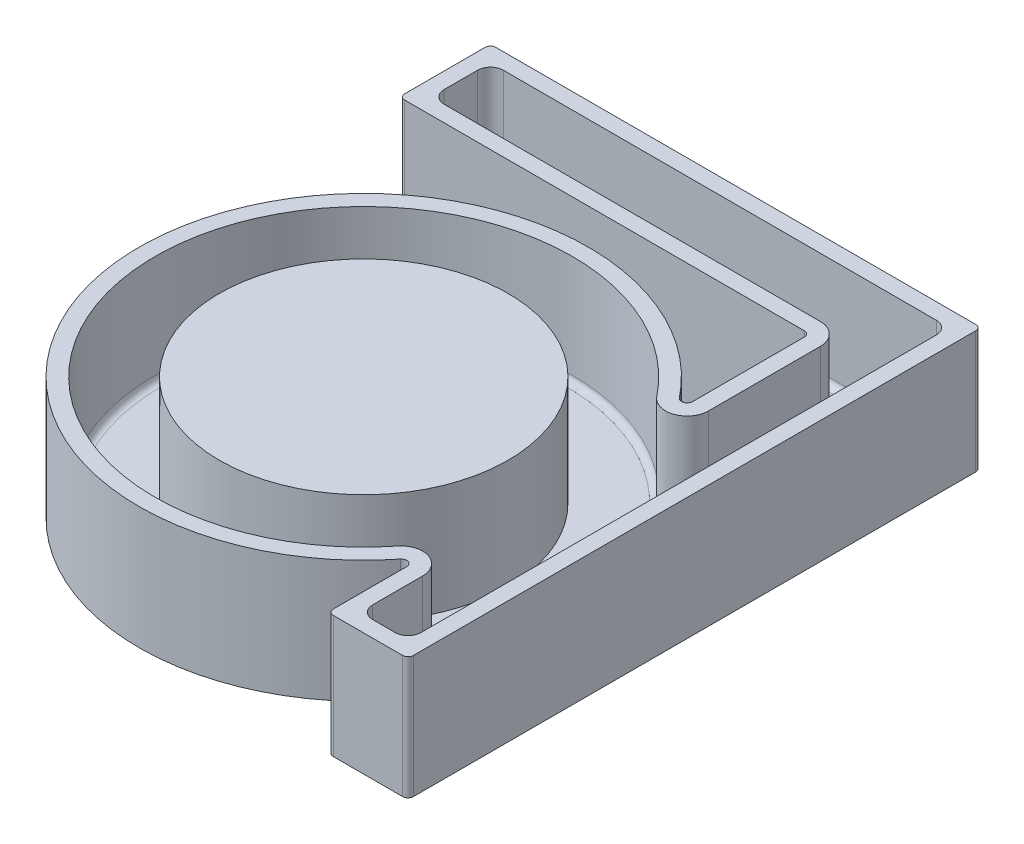
from build123d import *

# Parameters (mm, degrees)
BOSS_EXTRUDE1_DEPTH = 19.05
SKETCH2_R           = 22.5
CUT_EXTRUDE1_DEPTH  = 17.05
FILLET1_R           = 2
FILLET2_R           = 1


with BuildPart() as part:
    # Sketch1 → Boss-Extrude1 (new body)
    with BuildSketch(Plane(origin=(0, 0, 0), x_dir=(1, 0, 0), z_dir=(0, 1, 0))):
        with BuildLine():
            Line((30.602986827, -26.563786798), (41.395992873, -26.563786798))
            ThreePointArc((41.395992873, -26.563786798), (41.999506373, -26.313803321), (42.24948985, -25.710289821))
            Line((42.24948985, -25.710289821), (42.24948985, 54.289710179))
            Line((42.24948985, 54.289710179), (42.24948985, 61.876099251))
            ThreePointArc((42.24948985, 61.876099251), (41.999506373, 62.479612751), (41.395992873, 62.729596228))
            Line((41.395992873, 62.729596228), (-33.347013177, 62.729596228))
            ThreePointArc((-33.347013177, 62.729596228), (-33.950526677, 62.479612751), (-34.200510153, 61.876099251))
            Line((-34.200510153, 61.876099251), (-34.200510153, 49.376099251))
            ThreePointArc((-34.200510153, 49.376099251), (-33.950526677, 48.772585752), (-33.347013177, 48.522602275))
            Line((-33.347013177, 48.522602275), (28.895992873, 48.522602275))
            ThreePointArc((28.895992873, 48.522602275), (29.499506373, 48.272618798), (29.74948985, 47.669105298))
            Line((29.74948985, 47.669105298), (29.74948985, 30.255903719))
            ThreePointArc((29.74948985, 30.255903719), (29.176620882, 29.44986091), (28.227035694, 29.725853361))
            ThreePointArc((28.227035694, 29.725853361), (-34.205400414, 7.989675013), (28.227035694, -13.746503336))
            ThreePointArc((28.227035694, -13.746503336), (29.176620882, -13.470510884), (29.74948985, -14.276553693))
            Line((29.74948985, -14.276553693), (29.74948985, -25.710289821))
            ThreePointArc((29.74948985, -25.710289821), (29.999473327, -26.313803321), (30.602986827, -26.563786798))
        make_face()
    extrude(amount=BOSS_EXTRUDE1_DEPTH)

    # Sketch2 → Cut-Extrude1 (cut)
    with BuildSketch(Plane(origin=(0, 19.05, 0), x_dir=(1, 0, 0), z_dir=(0, 1, 0))):
        with BuildLine():
            Line((39.74948985, -24.063786798), (39.74948985, 60.229596228))
            Line((39.74948985, 60.229596228), (-31.700510153, 60.229596228))
            Line((-31.700510153, 60.229596228), (-31.700510153, 51.022602275))
            Line((-31.700510153, 51.022602275), (28.895992873, 51.022602275))
            ThreePointArc((28.895992873, 51.022602275), (31.267273326, 50.040385751), (32.24948985, 47.669105298))
            Line((32.24948985, 47.669105298), (32.24948985, 30.255903719))
            ThreePointArc((32.24948985, 30.255903719), (29.998615619, 27.088860136), (26.267575972, 28.173269194))
            ThreePointArc((26.267575972, 28.173269194), (-31.705400414, 7.989675013), (26.267575972, -12.193919168))
            ThreePointArc((26.267575972, -12.193919168), (29.998615619, -11.109510111), (32.24948985, -14.276553693))
            Line((32.24948985, -14.276553693), (32.24948985, -24.063786798))
            Line((32.24948985, -24.063786798), (39.74948985, -24.063786798))
        make_face()
        with Locations(Location((0.794599586, 7.989675013, 0), (0, 0, 270))):
            Circle(SKETCH2_R, mode=Mode.SUBTRACT)
    extrude(amount=-CUT_EXTRUDE1_DEPTH, mode=Mode.SUBTRACT)

    # Fillet1
    fillet1_edges = [part.edges().sort_by_distance(p)[0] for p in [
        (39.74948985, 10.525, 24.063786798),
        (32.24948985, 10.525, 24.063786798),
        (-31.700510153, 10.525, -51.022602275),
        (-31.700510153, 10.525, -60.229596228),
        (39.74948985, 10.525, -60.229596228),
    ]]
    fillet(fillet1_edges, radius=FILLET1_R)

    # Fillet2
    fillet2_edges = [part.edges().sort_by_distance(p)[0] for p in [
        (32.24948985, 2, 18.170170245),
        (29.998615619, 2, 11.109510111),
        (-31.705400414, 2, -7.989675013),
        (29.998615619, 2, -27.088860136),
        (32.24948985, 2, -38.962504508),
        (31.267273326, 2, -50.040385751),
        (35.99948985, 2, 24.063786798),
        (39.74948985, 2, -18.082904715),
        (4.024489848, 2, -60.229596228),
        (-31.700510153, 2, -55.626099251),
        (-0.40225864, 2, -51.022602275),
        (39.163703412, 2, -59.64380979),
        (-31.114723716, 2, -59.64380979),
        (-31.114723716, 2, -51.608388712),
        (39.163703412, 2, 23.47800036),
        (32.835276288, 2, 23.47800036),
    ]]
    fillet(fillet2_edges, radius=FILLET2_R)


solid = part.part
